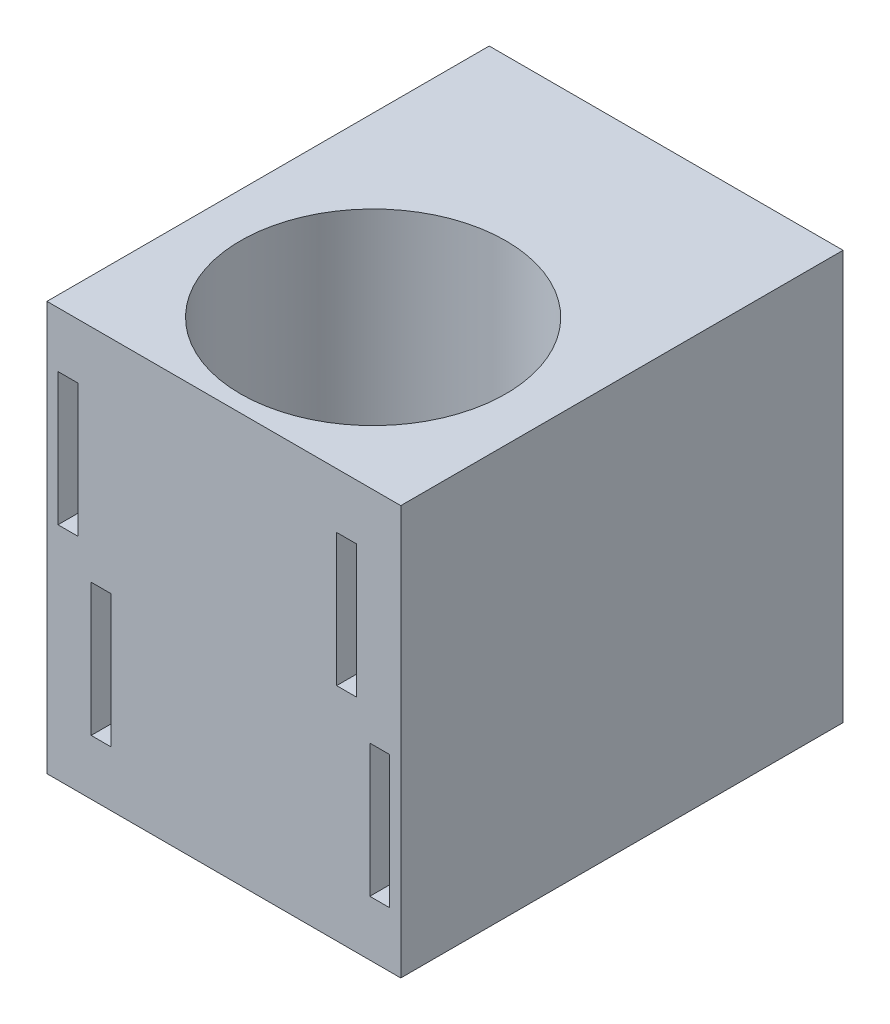
from build123d import *
from build123d.topology import SkipClean

# Parameters (mm, degrees)
SKETCH1_W           = 32
SKETCH1_H           = 27
SKETCH1_R           = 12
BOSS_EXTRUDE1_DEPTH = 30
SKETCH3_W           = 1.8
SKETCH3_H           = 12
CUT_EXTRUDE1_DEPTH  = 13.5
SKETCH4_W           = 1.8
SKETCH4_H           = 12
CUT_EXTRUDE2_DEPTH  = 44.416586692
SKETCH5_W           = 32
SKETCH5_H           = 30
SKETCH5_W_2         = 1.8
SKETCH5_H_2         = 12
BOSS_EXTRUDE2_DEPTH = 13
SKETCH6_W           = 32
SKETCH6_H           = 40
SKETCH6_R           = 12
BOSS_EXTRUDE3_DEPTH = 3.5
BOSS_EXTRUDE4_START = 3.5
SKETCH7_W           = 32
SKETCH7_H           = 40
SKETCH7_R           = 12
BOSS_EXTRUDE4_DEPTH = 3.5


with BuildPart() as part:
    # Sketch1 → Boss-Extrude1 (new body)
    with BuildSketch(Plane(origin=(0, 0, 0), x_dir=(1, 0, 0), z_dir=(0, 1, 0))):
        Rectangle(SKETCH1_W, SKETCH1_H)
        with Locations(Location((0, 0, 0), (0, 0, 270))):
            Circle(SKETCH1_R, mode=Mode.SUBTRACT)
    extrude(amount=BOSS_EXTRUDE1_DEPTH)

    # Sketch3 → Cut-Extrude1 (cut)
    with BuildSketch(Plane.XY.offset(13.5)):
        with Locations((-11.1, 7.5)):
            Rectangle(SKETCH3_W, SKETCH3_H)
        with Locations((11.1, 22.5)):
            Rectangle(SKETCH3_W, SKETCH3_H)
    extrude(amount=-CUT_EXTRUDE1_DEPTH, mode=Mode.SUBTRACT)

    # Sketch4 → Cut-Extrude2 (cut, through all)
    with BuildSketch(Plane.XY.offset(13.5)):
        with Locations((-14.1, 22.5)):
            Rectangle(SKETCH4_W, SKETCH4_H)
        with Locations((14.1, 7.5)):
            Rectangle(SKETCH4_W, SKETCH4_H)
    extrude(amount=-CUT_EXTRUDE2_DEPTH, mode=Mode.SUBTRACT)

    # Sketch5 → Boss-Extrude2 (add)
    with BuildSketch(Plane(origin=(0, 0, -13.5), x_dir=(-1, 0, 0), z_dir=(0, 0, -1))):
        with Locations((0, 15)):
            Rectangle(SKETCH5_W, SKETCH5_H)
        with Locations((14.1, 22.5)):
            Rectangle(SKETCH5_W_2, SKETCH5_H_2, mode=Mode.SUBTRACT)
        with Locations((-14.1, 7.5)):
            Rectangle(SKETCH5_W_2, SKETCH5_H_2, mode=Mode.SUBTRACT)
    extrude(amount=BOSS_EXTRUDE2_DEPTH)

    # Sketch6 → Boss-Extrude3 (add)
    with BuildSketch(Plane(origin=(0, 30, 0), x_dir=(1, 0, 0), z_dir=(0, 1, 0))):
        with Locations((0, 6.5)):
            Rectangle(SKETCH6_W, SKETCH6_H)
        with Locations(Location((0, 0, 0), (0, 0, 270))):
            Circle(SKETCH6_R, mode=Mode.SUBTRACT)
    extrude(amount=BOSS_EXTRUDE3_DEPTH)

    # Sketch7 → Boss-Extrude4 (add)
    with SkipClean():  # the faces are left unmerged after this step: merging them gives an invalid solid
        with BuildSketch(Plane.XZ.offset(BOSS_EXTRUDE4_START)):
            with Locations((0, -6.5)):
                Rectangle(SKETCH7_W, SKETCH7_H)
            with Locations(Location((0, 0, 0), (0, 0, 270))):
                Circle(SKETCH7_R, mode=Mode.SUBTRACT)
        extrude(amount=-BOSS_EXTRUDE4_DEPTH)


solid = part.part
